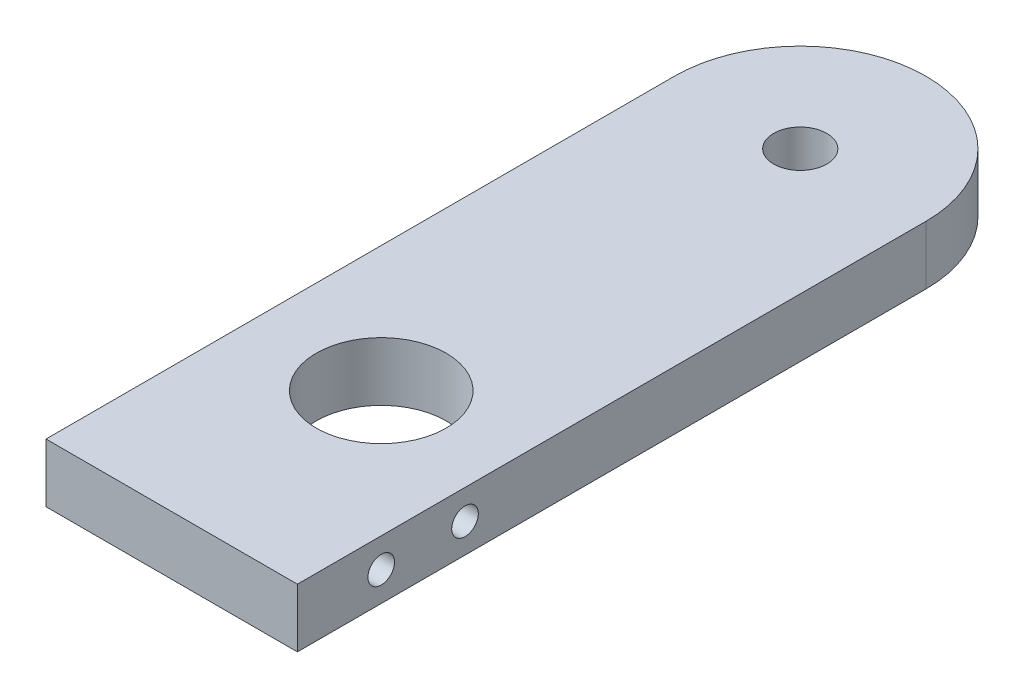
from build123d import *

# Parameters (mm, degrees)
BOSS_EXTRUDE1_DEPTH              = 7
F_1_8_0_125_DIAMETER_HOLE1_D     = 3.175
F_1_8_0_125_DIAMETER_HOLE1_DEPTH = 4.064
HOLE1_D                          = 15.5
F_1_4_0_25_DIAMETER_HOLE1_D      = 6.35


with BuildPart() as part:
    # Sketch1 → Boss-Extrude1 (new body)
    with BuildSketch(Plane(origin=(0, 7, 0), x_dir=(1, 0, 0), z_dir=(0, 1, 0))):
        with BuildLine():
            Line((-125.801197545, -29.648007087), (-125.801197545, 45.351992913))
            ThreePointArc((-125.801197545, 45.351992913), (-140.801197545, 60.351992913), (-155.801197545, 45.351992913))
            Line((-155.801197545, 45.351992913), (-155.801197545, -29.648007087))
            Line((-155.801197545, -29.648007087), (-125.801197545, -29.648007087))
        make_face()
    extrude(amount=-BOSS_EXTRUDE1_DEPTH)

    # 1/8 (0.125) Diameter Hole1
    with Locations(Plane(origin=(-125.801197545, 0, 0), x_dir=(0, 0, -1), z_dir=(1, 0, 0))):
        with Locations((-19.648007087, 3.5), (-9.648007087, 3.5)):
            Hole(F_1_8_0_125_DIAMETER_HOLE1_D / 2, depth=F_1_8_0_125_DIAMETER_HOLE1_DEPTH)

    # Hole1 (through all)
    with Locations(Plane(origin=(0, 0, 0), x_dir=(-1, 0, 0), z_dir=(0, -1, 0))):
        with Locations((140.801197545, -4.648007087)):
            Hole(HOLE1_D / 2)

    # 1/4 (0.25) Diameter Hole1 (through all)
    with Locations(Plane(origin=(0, 0, 0), x_dir=(-1, 0, 0), z_dir=(0, -1, 0))):
        with Locations((140.801197545, 45.351992913)):
            Hole(F_1_4_0_25_DIAMETER_HOLE1_D / 2)


solid = part.part
